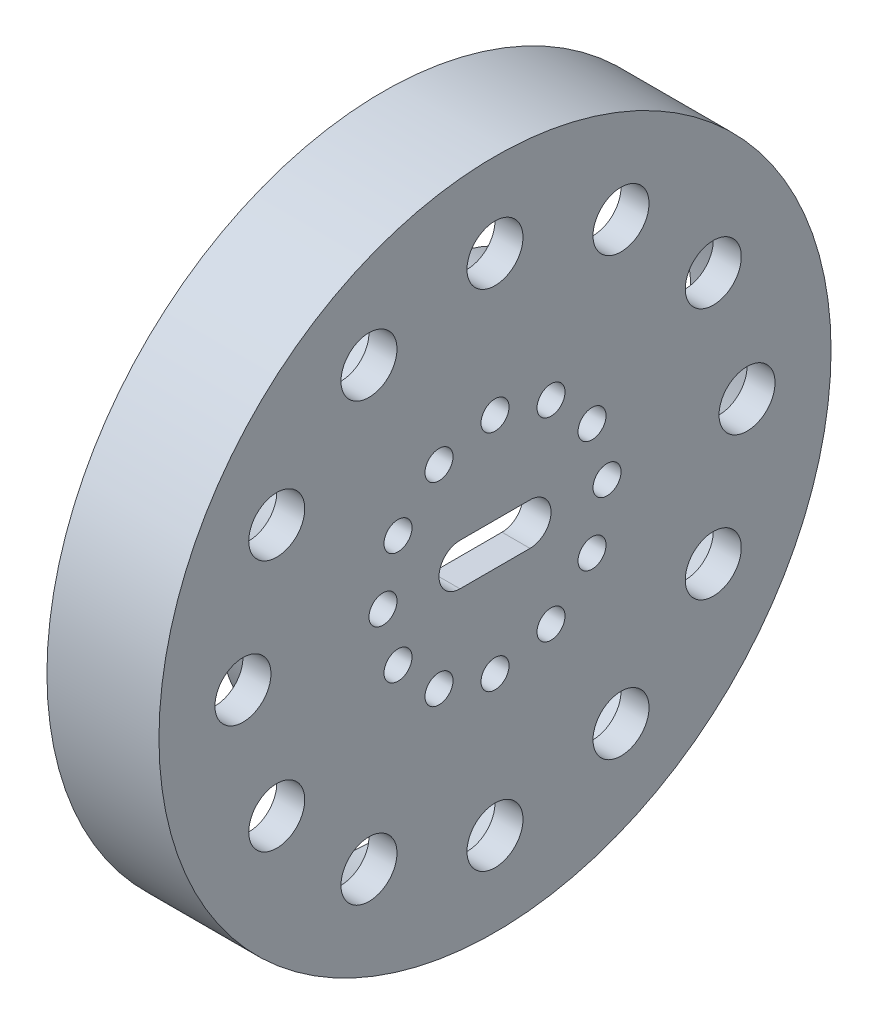
from build123d import *

# Parameters (mm, degrees)
SKETCH2_R          = 6.35
SKETCH2_R_2        = 3.175
CIRCULAR_CUT_DEPTH = 110.433918417
CIRPATTERN_COUNT   = 12
SLOT_CUT_DEPTH     = 110.433918417


with BuildPart() as part:
    # Sketch1 → Revolve 2 (revolve)
    with BuildSketch(Plane.XY, mode=Mode.PRIVATE) as revolve_2_sk:
        Polygon((0, 0), (0, 76.2), (-25.4, 76.2), (-25.4, 69.85), (-6.35, 69.85), (-6.35, 43.954479769), (-19.05, 43.954479769), (-19.05, 38.1), (-6.35, 38.1), (-6.35, 0), align=None)
    revolve(revolve_2_sk.sketch.rotate(Axis((-6.35, 0, 0), (1, 0, 0)), 90), axis=Axis((-6.35, 0, 0), (1, 0, 0)))

    # Sketch2 → Circular Cut (cut, through all)
    with BuildSketch(Plane.ZY.offset(6.35)):
        with Locations((57.15, 0)):
            Circle(SKETCH2_R)
        with Locations((25.4, 0)):
            Circle(SKETCH2_R_2)
    circular_cut = extrude(amount=-CIRCULAR_CUT_DEPTH, mode=Mode.SUBTRACT)

    # CirPattern: Circular Cut ×12 about axis
    cirpattern_axis = Axis((0, 0, 0), (1, 0, 0))
    for i in range(1, CIRPATTERN_COUNT):
        add(circular_cut.rotate(cirpattern_axis, i * 360 / CIRPATTERN_COUNT), mode=Mode.SUBTRACT)

    # Sketch5 → Slot Cut (cut, through all)
    with BuildSketch(Plane.ZY.offset(6.35)):
        with BuildLine():
            Line((-7.9375, 4.7625), (7.9375, 4.7625))
            ThreePointArc((7.9375, 4.7625), (12.7, 0), (7.9375, -4.7625))
            Line((7.9375, -4.7625), (-7.9375, -4.7625))
            ThreePointArc((-7.9375, -4.7625), (-12.7, 0), (-7.9375, 4.7625))
        make_face()
    extrude(amount=-SLOT_CUT_DEPTH, mode=Mode.SUBTRACT)


solid = part.part
